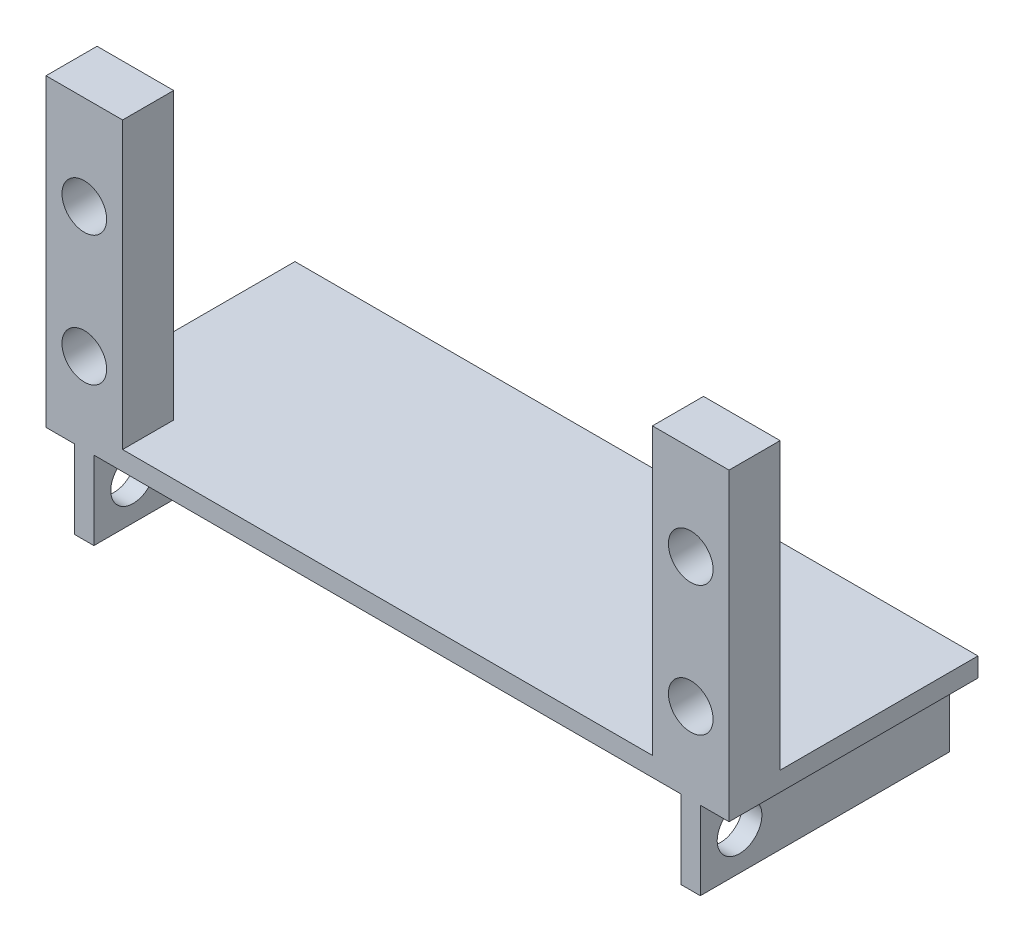
from build123d import *

# Parameters (mm, degrees)
ESQUISSE1_W             = 53.5
ESQUISSE1_H             = 19.5
BOSS_EXTRU_1_DEPTH      = 1.5
ESQUISSE2_W             = 6
ESQUISSE2_H             = 4
BOSS_EXTRU_2_DEPTH      = 22.356
ESQUISSE3_W             = 1.5
ESQUISSE3_H             = 19.5
BOSS_EXTRU_3_DEPTH      = 6.144
ESQUISSE4_W             = 46
ESQUISSE4_H             = 1.5
BOSS_EXTRU_4_DEPTH      = 6.144
ENL_V_MAT_EXTRU_1_REACH = 42.803
ESQUISSE5_R             = 1.75
ESQUISSE6_R             = 1.75
ENL_V_MAT_EXTRU_2_DEPTH = 58.364917293


with BuildPart() as part:
    # Esquisse1 → Boss.-Extru.1 (new body)
    with BuildSketch(Plane(origin=(0, 0, 0), x_dir=(1, 0, 0), z_dir=(0, 1, 0))):
        Rectangle(ESQUISSE1_W, ESQUISSE1_H)
    extrude(amount=BOSS_EXTRU_1_DEPTH)

    # Esquisse2 → Boss.-Extru.2 (add)
    with BuildSketch(Plane(origin=(0, 1.5, 0), x_dir=(1, 0, 0), z_dir=(0, 1, 0))):
        with Locations((-23.75, -7.75)):
            Rectangle(ESQUISSE2_W, ESQUISSE2_H)
        with Locations((23.75, -7.75)):
            Rectangle(ESQUISSE2_W, ESQUISSE2_H)
    extrude(amount=BOSS_EXTRU_2_DEPTH)

    # Esquisse3 → Boss.-Extru.3 (add)
    with BuildSketch(Plane.XZ):
        with Locations((-23.75, 0)):
            Rectangle(ESQUISSE3_W, ESQUISSE3_H)
    boss_extru_3 = extrude(amount=BOSS_EXTRU_3_DEPTH)

    # Symétrie1: Boss.-Extru.3 across plane
    add(boss_extru_3.mirror(Plane(origin=(0, 0, 0), x_dir=(0, 0, 1), z_dir=(1, 0, 0))))

    # Esquisse4 → Boss.-Extru.4 (add)
    with BuildSketch(Plane(origin=(0, 0, 0), x_dir=(-1, 0, 0), z_dir=(0, -1, 0))):
        with Locations((0, 9)):
            Rectangle(ESQUISSE4_W, ESQUISSE4_H)
    extrude(amount=BOSS_EXTRU_4_DEPTH)

    # Esquisse5 → Enlèv. mat.-Extru.1 (cut, up to next)
    with BuildSketch(Plane.XY.offset(9.75), mode=Mode.PRIVATE) as enl_v_mat_extru_1_sk1:
        with Locations((-23.75, 6.326)):
            Circle(ESQUISSE5_R)
    enl_v_mat_extru_1_tool1 = extrude(enl_v_mat_extru_1_sk1.sketch, amount=-ENL_V_MAT_EXTRU_1_REACH, mode=Mode.PRIVATE) & part.part
    # Esquisse5 → Enlèv. mat.-Extru.1 (cut, up to next)
    with BuildSketch(Plane.XY.offset(9.75), mode=Mode.PRIVATE) as enl_v_mat_extru_1_sk2:
        with Locations((-23.75, 16.486)):
            Circle(ESQUISSE5_R)
    enl_v_mat_extru_1_tool2 = extrude(enl_v_mat_extru_1_sk2.sketch, amount=-ENL_V_MAT_EXTRU_1_REACH, mode=Mode.PRIVATE) & part.part
    enl_v_mat_extru_1_1 = enl_v_mat_extru_1_tool1.solids().sort_by_distance((-23.75, 6.326, 9.75))[0]
    add(enl_v_mat_extru_1_1, mode=Mode.SUBTRACT)
    enl_v_mat_extru_1_2 = enl_v_mat_extru_1_tool2.solids().sort_by_distance((-23.75, 16.486, 9.75))[0]
    add(enl_v_mat_extru_1_2, mode=Mode.SUBTRACT)
    enl_v_mat_extru_1 = enl_v_mat_extru_1_1 + enl_v_mat_extru_1_2  # Enlèv. mat.-Extru.1 as one shape, for the pattern or mirror that repeats it

    # Symétrie2: Enlèv. mat.-Extru.1 across plane
    add(enl_v_mat_extru_1.mirror(Plane(origin=(0, 0, 0), x_dir=(0, 0, 1), z_dir=(1, 0, 0))), mode=Mode.SUBTRACT)

    # Esquisse6 → Enlèv. mat.-Extru.2 (cut, through all)
    with BuildSketch(Plane.ZY.offset(24.5)):
        with Locations((6.678, -3.072)):
            Circle(ESQUISSE6_R)
    extrude(amount=-ENL_V_MAT_EXTRU_2_DEPTH, mode=Mode.SUBTRACT)


solid = part.part
